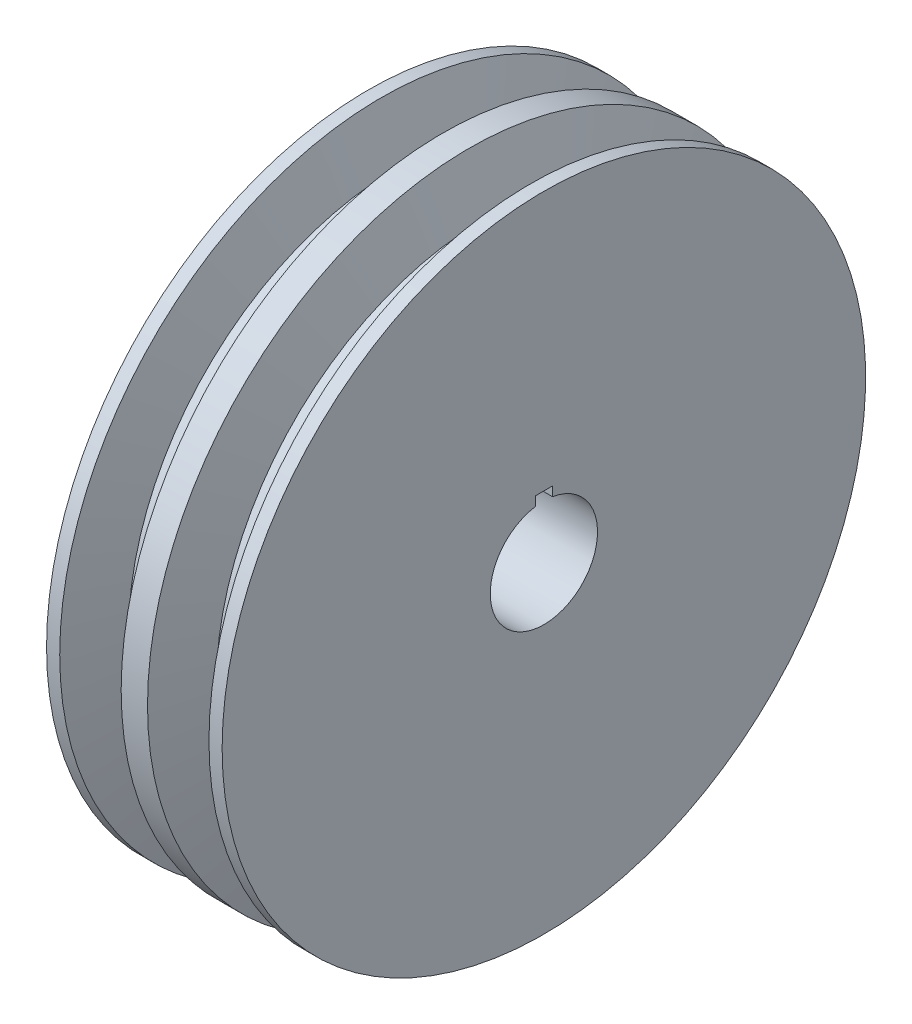
from build123d import *

# Parameters (mm, degrees)
IZIM2_R               = 20
KES_EKSTR_ZYON1_DEPTH = 160
IZIM3_R               = 25
KES_EKSTR_ZYON2_DEPTH = 120
KES_EKSTR_ZYON3_DEPTH = 120


with BuildPart() as part:
    # Çizim1 → Döndür1 (revolve)
    with BuildSketch(Plane(origin=(0, 0, 379.673045167), x_dir=(-1, 0, 0), z_dir=(0, 0, -1)), mode=Mode.PRIVATE) as d_nd_r1_sk:
        Polygon((-2016.208991354, 150), (-2016.208991354, 0), (-1934.353602541, 0), (-1934.353602541, 150), (-1940.492756702, 150), (-1948.000467843, 125.443383356), (-1961.634431646, 125.443383356), (-1969.142142787, 150), (-1981.420451109, 150), (-1988.928162249, 125.443383356), (-2002.562126052, 125.443383356), (-2010.069837193, 150), align=None)
    revolve(d_nd_r1_sk.sketch.rotate(Axis((2016.208991354, 0, 379.673045167), (-1, 0, 0)), 270), axis=Axis((2016.208991354, 0, 379.673045167), (-1, 0, 0)))

    # Çizim2 → Kes-Ekstrüzyon1 (cut)
    with BuildSketch(Plane.ZY.offset(-1934.353602541)):
        with Locations((379.673045167, 0)):
            Circle(IZIM2_R)
    extrude(amount=-KES_EKSTR_ZYON1_DEPTH, mode=Mode.SUBTRACT)

    # Çizim3 → Kes-Ekstrüzyon2 (cut)
    with BuildSketch(Plane(origin=(2016.208991354, 0, 0), x_dir=(0, 0, -1), z_dir=(1, 0, 0))):
        with Locations((-379.673045167, 0)):
            Circle(IZIM3_R)
    extrude(amount=-KES_EKSTR_ZYON2_DEPTH, mode=Mode.SUBTRACT)

    # Çizim4 → Kes-Ekstrüzyon3 (cut)
    with BuildSketch(Plane(origin=(2016.208991354, 0, 0), x_dir=(0, 0, -1), z_dir=(1, 0, 0))):
        with BuildLine():
            Line((-379.673045167, 29), (-379.673045167, 25))
            ThreePointArc((-379.673045167, 25), (-377.666572387, 24.919351255), (-375.673045167, 24.677925359))
            Line((-375.673045167, 24.677925359), (-375.673045167, 29))
            Line((-375.673045167, 29), (-379.673045167, 29))
        make_face()
        with BuildLine():
            ThreePointArc((-383.673045167, 24.677925359), (-381.679517947, 24.919351255), (-379.673045167, 25))
            Line((-379.673045167, 25), (-379.673045167, 29))
            Line((-379.673045167, 29), (-383.673045167, 29))
            Line((-383.673045167, 29), (-383.673045167, 24.677925359))
        make_face()
    extrude(amount=-KES_EKSTR_ZYON3_DEPTH, mode=Mode.SUBTRACT)


solid = part.part
